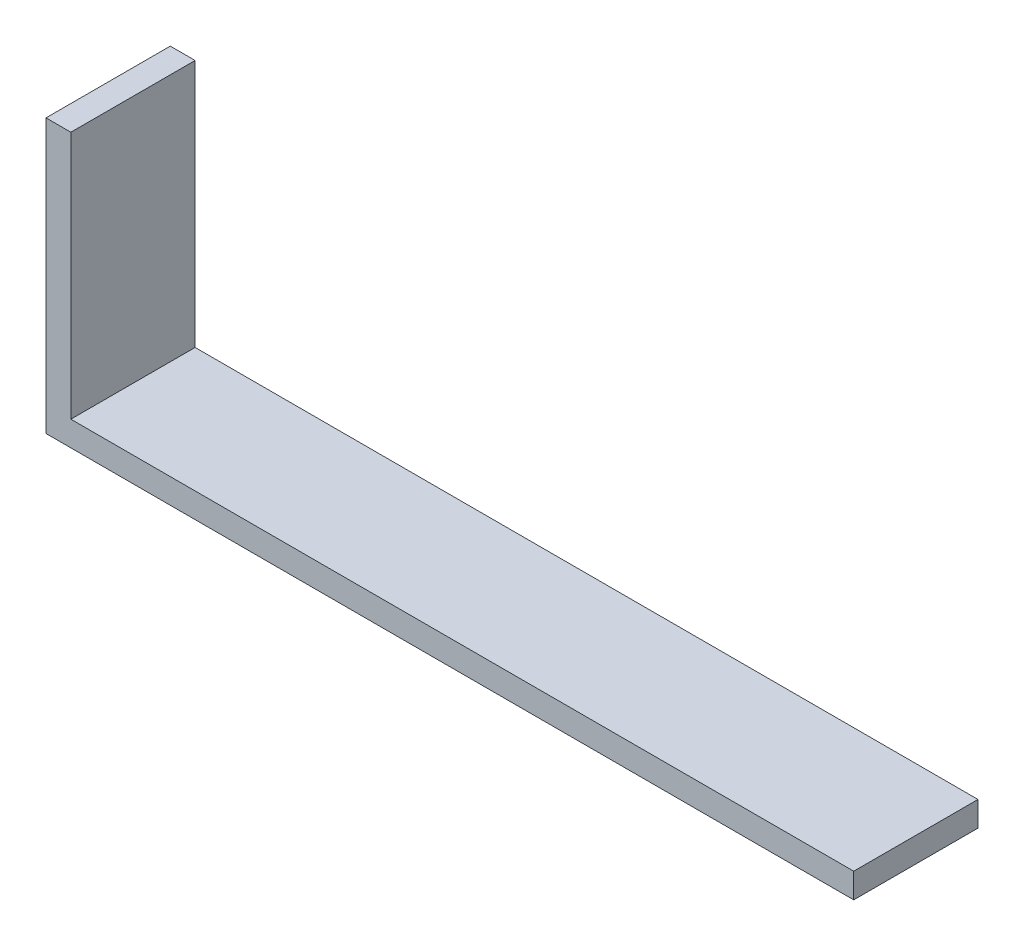
from build123d import *

# Parameters (mm, degrees)
BOSS_EXTRUDE1_DEPTH = 6.35


with BuildPart() as part:
    # Sketch1 → Boss-Extrude1 (new body)
    with BuildSketch(Plane.XY):
        Polygon((0, 5.981290323), (0, -7.988709677), (41.275, -7.988709677), (41.275, -6.718709677), (1.27, -6.718709677), (1.27, 5.981290323), align=None)
    extrude(amount=BOSS_EXTRUDE1_DEPTH)


solid = part.part
